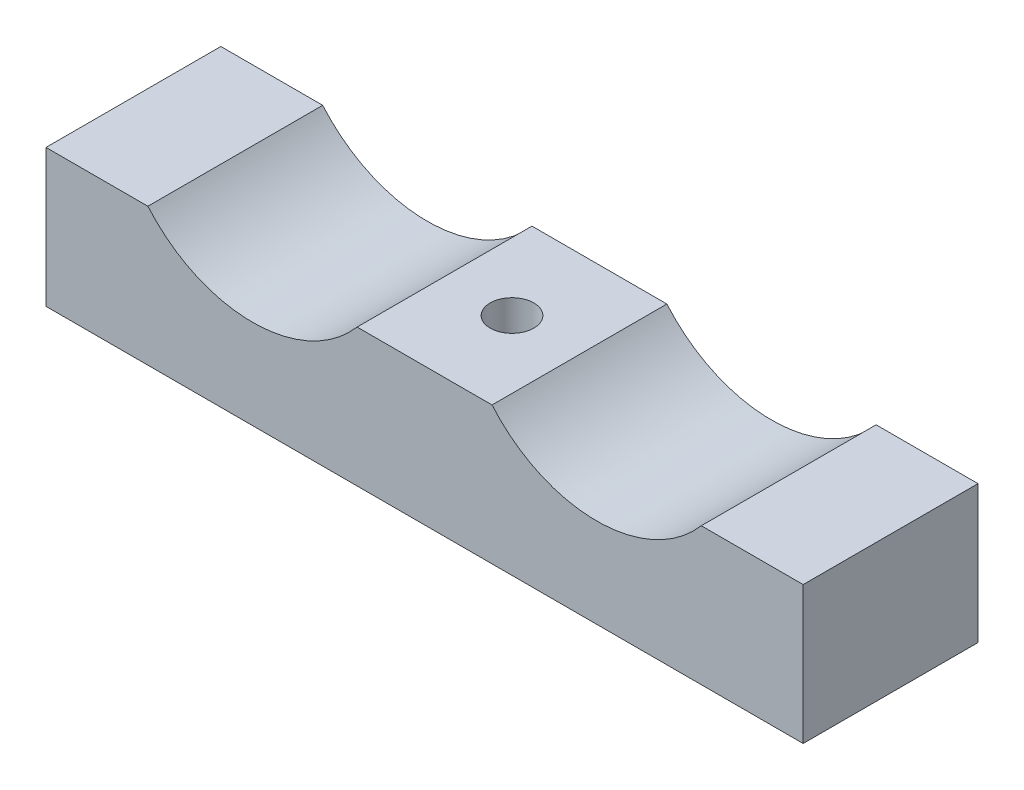
from build123d import *

# Parameters (mm, degrees)
SKETCH4_W           = 55
SKETCH4_H           = 10
BOSS_EXTRUDE1_DEPTH = 12.7
SKETCH5_R           = 10
CUT_EXTRUDE1_DEPTH  = 58.326172033
SKETCH8_R           = 1.5875
CUT_EXTRUDE3_DEPTH  = 58.326172033


with BuildPart() as part:
    # Sketch4 → Boss-Extrude1 (new body)
    with BuildSketch(Plane.XY):
        with Locations((27.5, 5)):
            Rectangle(SKETCH4_W, SKETCH4_H)
    extrude(amount=BOSS_EXTRUDE1_DEPTH)

    # Sketch5 → Cut-Extrude1 (cut, through all)
    with BuildSketch(Plane.XY.offset(12.7)):
        with Locations((15, 16.5)):
            Circle(SKETCH5_R)
        with Locations((40, 16.5)):
            Circle(SKETCH5_R)
    extrude(amount=-CUT_EXTRUDE1_DEPTH, mode=Mode.SUBTRACT)

    # Sketch8 → Cut-Extrude3 (cut, through all)
    with BuildSketch(Plane(origin=(0, 10, 0), x_dir=(1, 0, 0), z_dir=(0, 1, 0))):
        with Locations(Location((27.5, -6.35, 0), (0, 0, 270))):
            Circle(SKETCH8_R)
    extrude(amount=-CUT_EXTRUDE3_DEPTH, mode=Mode.SUBTRACT)


solid = part.part
